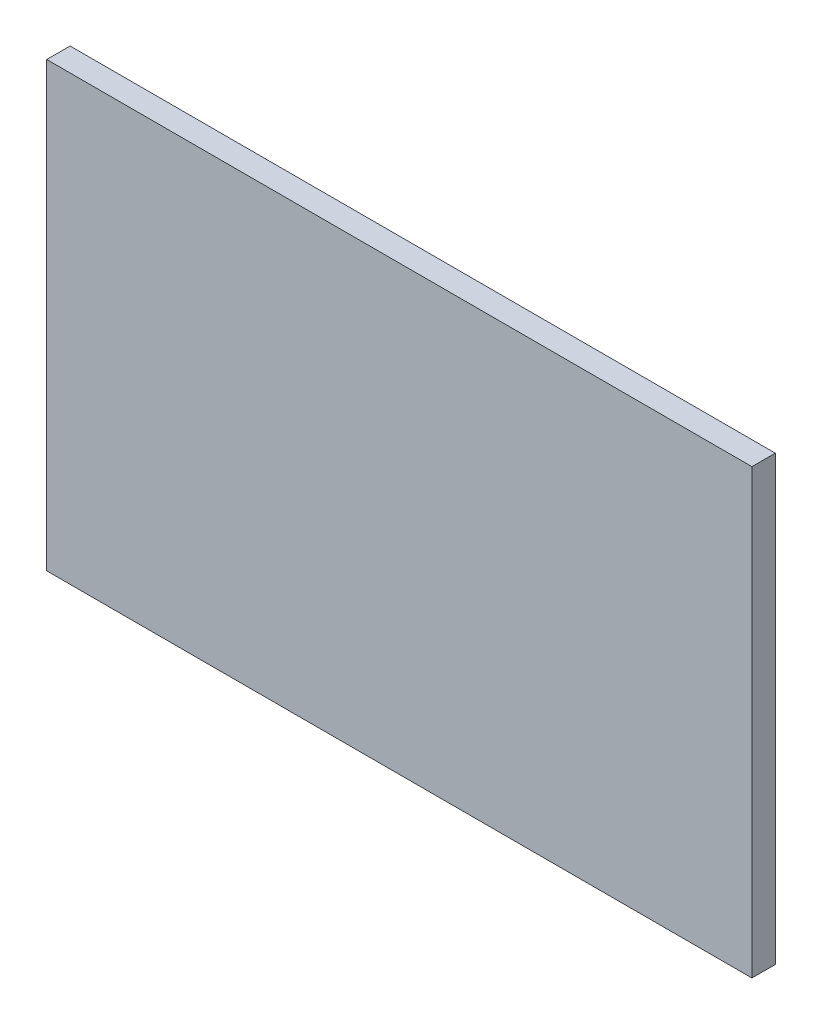
from build123d import *

# Parameters (mm, degrees)
SKETCH_1_W      = 120.7
SKETCH_1_H      = 75.8
EXTRUDE_1_DEPTH = 4


with BuildPart() as part:
    # 草图1 → 凸台-拉伸1 (new body)
    with BuildSketch(Plane(origin=(0, 0, 118.017510674), x_dir=(-1, 0, 0), z_dir=(0, 0, -1))):
        with Locations((8.722088665, 2.041638438)):
            Rectangle(SKETCH_1_W, SKETCH_1_H)
    extrude(amount=EXTRUDE_1_DEPTH)


solid = part.part
